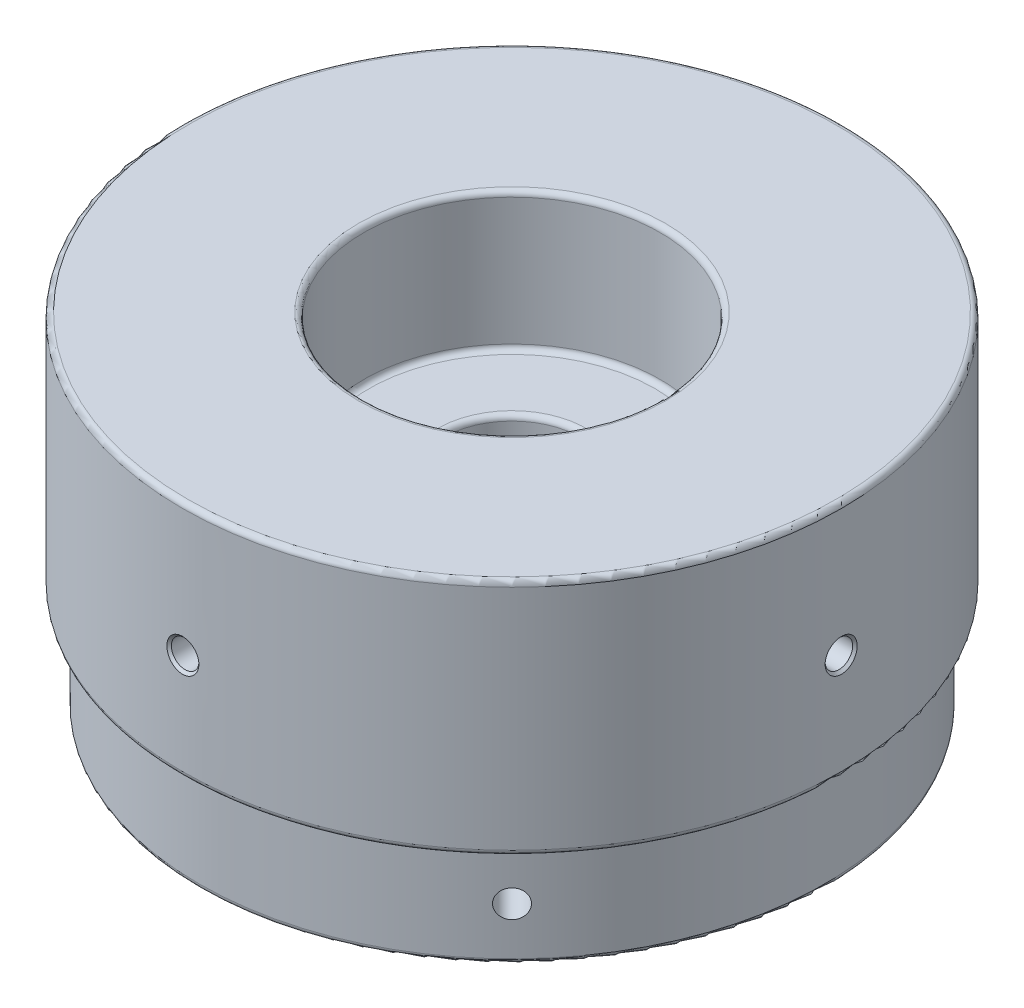
from build123d import *

# Parameters (mm, degrees)
IZIM1_R                             = 62.2
Y_KSEKLIK_EKSTR_ZYON1_DEPTH         = 32.5
IZIM2_R                             = 28
KES_EKSTR_ZYON1_DEPTH               = 26
IZIM3_R                             = 13
KES_EKSTR_ZYON2_DEPTH               = 20
KES_EKSTR_ZYON3_START               = -20
IZIM4_R                             = 62.2
IZIM4_R_2                           = 59
KES_EKSTR_ZYON3_DEPTH               = 20
DAIRESEL_KAPLAMA1_COUNT             = 4
DAIRESEL_KAPLAMA3_COUNT             = 4
RADYUS2_R                           = 1
M8X1_0_HELISARMAL_IN_DI_LI_DELIK3_D = 8.25


with BuildPart() as part:
    # Çizim1 → Yükseklik-Ekstrüzyon1 (new, symmetric)
    with BuildSketch(Plane(origin=(0, 0, 0), x_dir=(1, 0, 0), z_dir=(0, 1, 0))):
        with Locations(Location((0, 0, 0), (0, 0, 270))):
            Circle(IZIM1_R)
    extrude(amount=Y_KSEKLIK_EKSTR_ZYON1_DEPTH, both=True)

    # Çizim2 → Kes-Ekstrüzyon1 (cut)
    with BuildSketch(Plane(origin=(0, 32.5, 0), x_dir=(1, 0, 0), z_dir=(0, 1, 0))):
        with Locations(Location((0, 0, 0), (0, 0, 270))):
            Circle(IZIM2_R)
    extrude(amount=-KES_EKSTR_ZYON1_DEPTH, mode=Mode.SUBTRACT)

    # Çizim3 → Kes-Ekstrüzyon2 (cut)
    with BuildSketch(Plane(origin=(0, 6.5, 0), x_dir=(1, 0, 0), z_dir=(0, 1, 0))):
        with Locations(Location((0, 0, 0), (0, 0, 270))):
            Circle(IZIM3_R)
    extrude(amount=-KES_EKSTR_ZYON2_DEPTH, mode=Mode.SUBTRACT)

    # Çizim4 → Kes-Ekstrüzyon3 (cut)
    with BuildSketch(Plane.XZ.offset(32.5).offset(KES_EKSTR_ZYON3_START)):
        with Locations(Location((0, 0, 0), (0, 0, 270))):
            Circle(IZIM4_R)
        with Locations(Location((0, 0, 0), (0, 0, 270))):
            Circle(IZIM4_R_2, mode=Mode.SUBTRACT)
    extrude(amount=KES_EKSTR_ZYON3_DEPTH, mode=Mode.SUBTRACT)

    # Çizim9 → M5x0.8 Helisarmal İçin Dişli Delik2 (revolve, cut)
    with BuildSketch(Plane(origin=(62.2, 7.5, 0), x_dir=(0, 0, -1), z_dir=(0, 1, 0))):
        Polygon((0, 0), (0, 13.862237609), (2.6, 12.3), (2.6, 0.4975), (3.0975, 0), align=None)
    m5x0_8_helisarmal_in_di_li_delik2 = revolve(axis=Axis((68.55, 7.5, 0), (-1, 0, 0)), mode=Mode.SUBTRACT)

    # Dairesel Kaplama1: M5x0.8 Helisarmal İçin Dişli Delik2 ×4 about axis
    dairesel_kaplama1_axis = Axis((0, 32.5, 0), (0, 1, 0))
    for i in range(1, DAIRESEL_KAPLAMA1_COUNT):
        add(m5x0_8_helisarmal_in_di_li_delik2.rotate(dairesel_kaplama1_axis, i * 360 / DAIRESEL_KAPLAMA1_COUNT), mode=Mode.SUBTRACT)

    # Çizim24 → M5x0.8 Helisarmal İçin Dişli Delik6 (revolve, cut)
    with BuildSketch(Plane(origin=(41.71930009, -22.5, 41.71930009), x_dir=(0.707106781186549, 0, -0.707106781186546), z_dir=(0, 1, 0))):
        Polygon((0, 0), (0, 9.862237609), (2.6, 8.3), (2.6, 0), align=None)
    m5x0_8_helisarmal_in_di_li_delik6 = revolve(axis=Axis((46.209428151, -22.5, 46.209428151), (-0.707106781186546, 0, -0.707106781186549)), mode=Mode.SUBTRACT)

    # Dairesel Kaplama3: M5x0.8 Helisarmal İçin Dişli Delik6 ×4 about axis
    dairesel_kaplama3_axis = Axis((0, -32.5, 0), (0, -1, 0))
    for i in range(1, DAIRESEL_KAPLAMA3_COUNT):
        add(m5x0_8_helisarmal_in_di_li_delik6.rotate(dairesel_kaplama3_axis, i * 360 / DAIRESEL_KAPLAMA3_COUNT), mode=Mode.SUBTRACT)

    # Radyus2
    radyus2_edges = [part.edges().sort_by_distance(p)[0] for p in [
        (0, -13.5, -13),
        (0, 6.5, -13),
        (0, -12.5, -62.2),
        (0, -32.5, 59),
        (0, 32.5, -62.2),
        (0, 6.5, -28),
        (0, 32.5, -28),
    ]]
    fillet(radyus2_edges, radius=RADYUS2_R)

    # M8x1.0 Helisarmal İçin Dişli Delik3 (through all)
    with Locations(Plane.XZ.offset(32.5)):
        with Locations((0, 0)):
            Hole(M8X1_0_HELISARMAL_IN_DI_LI_DELIK3_D / 2)


solid = part.part
